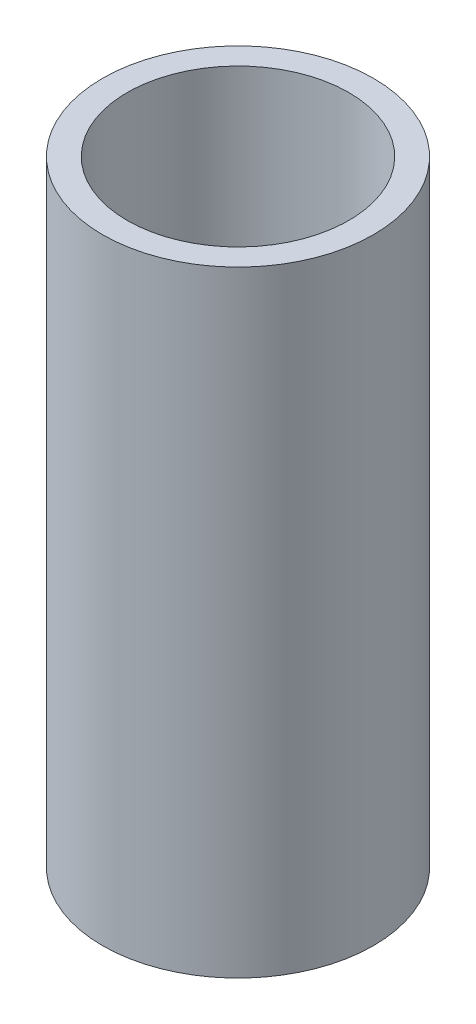
from build123d import *

# Parameters (mm, degrees)
SKETCH1_R           = 11
SKETCH1_R_2         = 9
BOSS_EXTRUDE1_DEPTH = 50


with BuildPart() as part:
    # Sketch1 → Boss-Extrude1 (new body)
    with BuildSketch(Plane(origin=(0, 0, 0), x_dir=(1, 0, 0), z_dir=(0, 1, 0))):
        with Locations(Location((0, 0, 0), (0, 0, 270))):
            Circle(SKETCH1_R)
        with Locations(Location((0, 0, 0), (0, 0, 270))):
            Circle(SKETCH1_R_2, mode=Mode.SUBTRACT)
    extrude(amount=BOSS_EXTRUDE1_DEPTH)


solid = part.part
